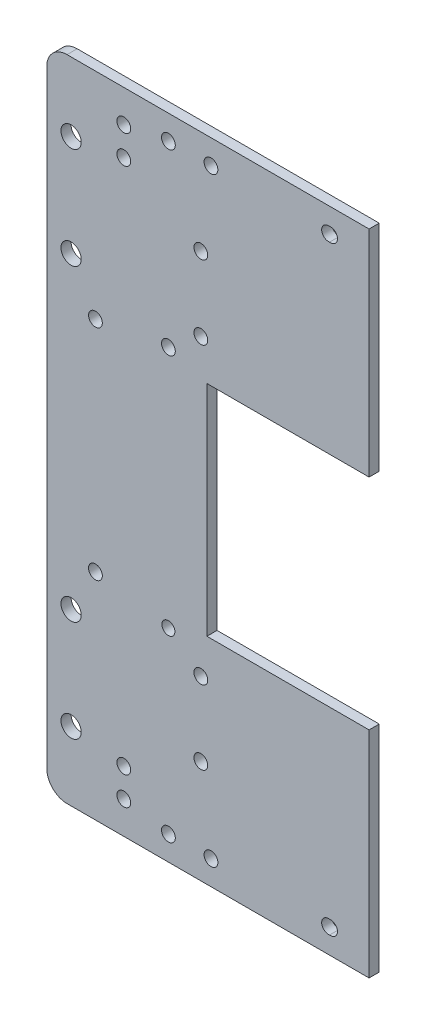
from build123d import *

# Parameters (mm, degrees)
SKETCH_1_W                  = 82
SKETCH_1_H                  = 160
EXTRUDE_1_DEPTH             = 50
SKETCH_2_W                  = 79.5
SKETCH_2_H                  = 47.5
CUT_EXTRUDE_1_DEPTH         = 187.611896727
CUT_EXTRUDE_2_DEPTH         = 186.95765647
CUT_EXTRUDE_4_DEPTH         = 186.95765647
CUT_EXTRUDE_5_DEPTH         = 186.95765647
CUT_EXTRUDE_7_DEPTH         = 186.95765647
CUT_EXTRUDE_9_DEPTH         = 187.611896727
CUT_EXTRUDE_10_DEPTH        = 187.611896727
CUT_EXTRUDE_11_DEPTH        = 187.611896727
CUT_EXTRUDE_12_DEPTH        = 187.611896727
CUT_EXTRUDE_13_DEPTH        = 187.611896727
CUT_EXTRUDE_14_DEPTH        = 187.611896727
CUT_EXTRUDE_15_DEPTH        = 187.611896727
CUT_EXTRUDE_16_DEPTH        = 187.611896727
CUT_EXTRUDE_17_DEPTH        = 187.611896727
CUT_EXTRUDE_18_DEPTH        = 187.611896727
CUT_EXTRUDE_19_DEPTH        = 187.611896727
DRAFT_1_ANGLE               = 30
DRAFT_2_ANGLE               = 30
HOLE_WIZARD_3_2_3_2_1_D     = 3.2
HOLE_WIZARD_3_2_3_2_1_DEPTH = 50
HOLE_WIZARD_3_4_3_4_1_D     = 3.4
HOLE_WIZARD_3_4_3_4_1_DEPTH = 50
HOLE_WIZARD_3_2_3_2_2_D     = 3.2
HOLE_WIZARD_3_2_3_2_2_DEPTH = 82
HOLE_WIZARD_5_0_5_1_D       = 5
HOLE_WIZARD_5_0_5_1_DEPTH   = 50
FILLET_3_R                  = 5
SKETCH_31_W                 = 2.5
SKETCH_31_H                 = 160
CUT_EXTRUDE_21_DEPTH        = 10
SKETCH_32_R                 = 1.7
CUT_EXTRUDE_22_DEPTH        = 10
SKETCH_33_R                 = 1.7
CUT_EXTRUDE_23_DEPTH        = 10
SKETCH_34_W                 = 60.596480557
SKETCH_34_H                 = 37.741752596
SKETCH_34_W_2               = 35.854664966
SKETCH_34_H_2               = 6.290292099
SKETCH_34_W_3               = 37.951428999
SKETCH_34_H_3               = 7.758026922
SKETCH_34_W_4               = 17.193465071
SKETCH_34_H_4               = 10.693496569
SKETCH_34_W_5               = 15.306377442
SKETCH_34_H_5               = 12.999937006
EXTRUDE_2_DEPTH             = 2.5
SKETCH_35_W                 = 40
SKETCH_35_H                 = 27
CUT_EXTRUDE_24_DEPTH        = 179.679881352
SKETCH_37_R                 = 1.7
CUT_EXTRUDE_25_DEPTH        = 10


with BuildPart() as part:
    # 草图1 → 凸台-拉伸1 (new body)
    with BuildSketch(Plane(origin=(0, 0, -50), x_dir=(-1, 0, 0), z_dir=(0, 0, -1))):
        with Locations((-41, 80)):
            Rectangle(SKETCH_1_W, SKETCH_1_H)
    extrude(amount=-EXTRUDE_1_DEPTH)

    # 草图2 → 切除-拉伸1 (cut, through all)
    with BuildSketch(Plane(origin=(0, 160, 0), x_dir=(-1, 0, 0), z_dir=(0, 1, 0))):
        with Locations((-39.75, -26.25)):
            Rectangle(SKETCH_2_W, SKETCH_2_H)
    extrude(amount=-CUT_EXTRUDE_1_DEPTH, mode=Mode.SUBTRACT)

    # 草图3 → 切除-拉伸2 (cut, through all)
    with BuildSketch(Plane(origin=(0, 0, -2.5), x_dir=(-1, 0, 0), z_dir=(0, 0, -1))):
        with BuildLine():
            Line((-65, 89.5), (-20, 89.5))
            ThreePointArc((-20, 89.5), (-17.5, 92), (-20, 94.5))
            Line((-20, 94.5), (-65, 94.5))
            ThreePointArc((-65, 94.5), (-67.5, 92), (-65, 89.5))
        make_face()
    extrude(amount=-CUT_EXTRUDE_2_DEPTH, mode=Mode.SUBTRACT)

    # 草图5 → 切除-拉伸4 (cut, through all)
    with BuildSketch(Plane(origin=(0, 0, -2.5), x_dir=(-1, 0, 0), z_dir=(0, 0, -1))):
        with BuildLine():
            Line((-65, 65.5), (-20, 65.5))
            ThreePointArc((-20, 65.5), (-17.5, 68), (-20, 70.5))
            Line((-20, 70.5), (-65, 70.5))
            ThreePointArc((-65, 70.5), (-67.5, 68), (-65, 65.5))
        make_face()
    extrude(amount=-CUT_EXTRUDE_4_DEPTH, mode=Mode.SUBTRACT)

    # 草图6 → 切除-拉伸5 (cut, through all)
    with BuildSketch(Plane(origin=(0, 0, -2.5), x_dir=(-1, 0, 0), z_dir=(0, 0, -1))):
        with BuildLine():
            Line((-68, 50), (-38, 50))
            ThreePointArc((-38, 50), (-36.4, 51.6), (-38, 53.2))
            Line((-38, 53.2), (-68, 53.2))
            ThreePointArc((-68, 53.2), (-69.6, 51.6), (-68, 50))
        make_face()
    extrude(amount=-CUT_EXTRUDE_5_DEPTH, mode=Mode.SUBTRACT)

    # 草图8 → 切除-拉伸7 (cut, through all)
    with BuildSketch(Plane(origin=(0, 0, -2.5), x_dir=(-1, 0, 0), z_dir=(0, 0, -1))):
        with BuildLine():
            Line((-68, 106.8), (-38, 106.8))
            ThreePointArc((-38, 106.8), (-36.4, 108.4), (-38, 110))
            Line((-38, 110), (-68, 110))
            ThreePointArc((-68, 110), (-69.6, 108.4), (-68, 106.8))
        make_face()
    extrude(amount=-CUT_EXTRUDE_7_DEPTH, mode=Mode.SUBTRACT)

    # 草图10 → 切除-拉伸9 (cut, through all)
    with BuildSketch(Plane(origin=(82, 0, 0), x_dir=(0, 0, -1), z_dir=(1, 0, 0))):
        with BuildLine():
            Line((20.690598923, 80), (16.690598923, 86.92820323))
            ThreePointArc((16.690598923, 86.92820323), (13.629378785, 80), (16.690598923, 73.07179677))
            Line((16.690598923, 73.07179677), (20.690598923, 80))
        make_face()
    extrude(amount=-CUT_EXTRUDE_9_DEPTH, mode=Mode.SUBTRACT)

    # 草图11 → 切除-拉伸10 (cut, through all)
    with BuildSketch(Plane(origin=(82, 0, 0), x_dir=(0, 0, -1), z_dir=(1, 0, 0))):
        with BuildLine():
            Line((24.154700538, 89.29920473), (24.154700538, 82))
            Line((24.154700538, 82), (32.154700538, 82))
            ThreePointArc((32.154700538, 82), (29.315895428, 86.922283358), (24.154700538, 89.29920473))
        make_face()
    extrude(amount=-CUT_EXTRUDE_10_DEPTH, mode=Mode.SUBTRACT)

    # 草图12 → 切除-拉伸11 (cut, through all)
    with BuildSketch(Plane(origin=(82, 0, 0), x_dir=(0, 0, -1), z_dir=(1, 0, 0))):
        with BuildLine():
            Line((24.154700538, 78), (24.154700538, 70.70079527))
            ThreePointArc((24.154700538, 70.70079527), (29.315895428, 73.077716642), (32.154700538, 78))
            Line((32.154700538, 78), (24.154700538, 78))
        make_face()
    extrude(amount=-CUT_EXTRUDE_11_DEPTH, mode=Mode.SUBTRACT)

    # 草图13 → 切除-拉伸12 (cut, through all)
    with BuildSketch(Plane(origin=(82, 0, 0), x_dir=(0, 0, -1), z_dir=(1, 0, 0))):
        with BuildLine():
            Line((36, 21.2), (14, 21.2))
            ThreePointArc((14, 21.2), (12.4, 19.6), (14, 18))
            Line((14, 18), (36, 18))
            ThreePointArc((36, 18), (37.6, 19.6), (36, 21.2))
        make_face()
    extrude(amount=-CUT_EXTRUDE_12_DEPTH, mode=Mode.SUBTRACT)

    # 草图14 → 切除-拉伸13 (cut, through all)
    with BuildSketch(Plane(origin=(82, 0, 0), x_dir=(0, 0, -1), z_dir=(1, 0, 0))):
        with BuildLine():
            Line((36, 31.2), (14, 31.2))
            ThreePointArc((14, 31.2), (12.4, 29.6), (14, 28))
            Line((14, 28), (36, 28))
            ThreePointArc((36, 28), (37.6, 29.6), (36, 31.2))
        make_face()
    extrude(amount=-CUT_EXTRUDE_13_DEPTH, mode=Mode.SUBTRACT)

    # 草图15 → 切除-拉伸14 (cut, through all)
    with BuildSketch(Plane(origin=(82, 0, 0), x_dir=(0, 0, -1), z_dir=(1, 0, 0))):
        with BuildLine():
            Line((36, 41.2), (14, 41.2))
            ThreePointArc((14, 41.2), (12.4, 39.6), (14, 38))
            Line((14, 38), (36, 38))
            ThreePointArc((36, 38), (37.6, 39.6), (36, 41.2))
        make_face()
    extrude(amount=-CUT_EXTRUDE_14_DEPTH, mode=Mode.SUBTRACT)

    # 草图16 → 切除-拉伸15 (cut, through all)
    with BuildSketch(Plane(origin=(82, 0, 0), x_dir=(0, 0, -1), z_dir=(1, 0, 0))):
        with BuildLine():
            Line((36, 51.2), (14, 51.2))
            ThreePointArc((14, 51.2), (12.4, 49.6), (14, 48))
            Line((14, 48), (36, 48))
            ThreePointArc((36, 48), (37.6, 49.6), (36, 51.2))
        make_face()
    extrude(amount=-CUT_EXTRUDE_15_DEPTH, mode=Mode.SUBTRACT)

    # 草图17 → 切除-拉伸16 (cut, through all)
    with BuildSketch(Plane(origin=(82, 0, 0), x_dir=(0, 0, -1), z_dir=(1, 0, 0))):
        with BuildLine():
            Line((36, 112), (14, 112))
            ThreePointArc((14, 112), (12.4, 110.4), (14, 108.8))
            Line((14, 108.8), (36, 108.8))
            ThreePointArc((36, 108.8), (37.6, 110.4), (36, 112))
        make_face()
    extrude(amount=-CUT_EXTRUDE_16_DEPTH, mode=Mode.SUBTRACT)

    # 草图18 → 切除-拉伸17 (cut, through all)
    with BuildSketch(Plane(origin=(82, 0, 0), x_dir=(0, 0, -1), z_dir=(1, 0, 0))):
        with BuildLine():
            Line((36, 122), (14, 122))
            ThreePointArc((14, 122), (12.4, 120.4), (14, 118.8))
            Line((14, 118.8), (36, 118.8))
            ThreePointArc((36, 118.8), (37.6, 120.4), (36, 122))
        make_face()
    extrude(amount=-CUT_EXTRUDE_17_DEPTH, mode=Mode.SUBTRACT)

    # 草图19 → 切除-拉伸18 (cut, through all)
    with BuildSketch(Plane(origin=(82, 0, 0), x_dir=(0, 0, -1), z_dir=(1, 0, 0))):
        with BuildLine():
            Line((36, 132), (14, 132))
            ThreePointArc((14, 132), (12.4, 130.4), (14, 128.8))
            Line((14, 128.8), (36, 128.8))
            ThreePointArc((36, 128.8), (37.6, 130.4), (36, 132))
        make_face()
    extrude(amount=-CUT_EXTRUDE_18_DEPTH, mode=Mode.SUBTRACT)

    # 草图20 → 切除-拉伸19 (cut, through all)
    with BuildSketch(Plane(origin=(82, 0, 0), x_dir=(0, 0, -1), z_dir=(1, 0, 0))):
        with BuildLine():
            Line((36, 142), (14, 142))
            ThreePointArc((14, 142), (12.4, 140.4), (14, 138.8))
            Line((14, 138.8), (36, 138.8))
            ThreePointArc((36, 138.8), (37.6, 140.4), (36, 142))
        make_face()
    extrude(amount=-CUT_EXTRUDE_19_DEPTH, mode=Mode.SUBTRACT)

    # 拔模1
    draft_1_faces = [part.faces().sort_by_distance(p)[0] for p in [
        (80.75, 85.649602365, -24.154700538),
    ]]
    draft(draft_1_faces, Plane(origin=(0, 82, -24.154700538), x_dir=(0, 0, 1), z_dir=(0, 1, 0)), DRAFT_1_ANGLE)

    # 拔模2
    draft_2_faces = [part.faces().sort_by_distance(p)[0] for p in [
        (80.75, 74.350397635, -24.154700538),
    ]]
    draft(draft_2_faces, Plane(origin=(0, 78, -32.154700538), x_dir=(0, 0, -1), z_dir=(0, -1, 0)), DRAFT_2_ANGLE)

    # Ø3.2 (3.2) 直径孔1
    with Locations(Plane.XY):
        with Locations((30, 32.75), (30, 38.75), (30, 50)):
            Hole(HOLE_WIZARD_3_2_3_2_1_D / 2, depth=HOLE_WIZARD_3_2_3_2_1_DEPTH)

    # Ø3.4 (3.4) 直径孔1
    with Locations(Plane.XY):
        with Locations((30, 154), (40.5, 154), (69.5, 154), (69.5, 6), (40.5, 6), (30, 6), (30, 121.25), (30, 127.25), (30, 110), (19, 8), (19, 15), (19, 145), (12, 53), (12, 107), (19, 152), (22, 124.25), (22, 35.75)):
            Hole(HOLE_WIZARD_3_4_3_4_1_D / 2, depth=HOLE_WIZARD_3_4_3_4_1_DEPTH)

    # Ø3.2 (3.2) 直径孔2
    with Locations(Plane(origin=(82, 0, 0), x_dir=(0, 0, -1), z_dir=(1, 0, 0))):
        with Locations((9.5, 150), (17.5, 150), (25.5, 150), (33.5, 150), (41.5, 150), (41.5, 10), (33.5, 10), (25.5, 10), (17.5, 10), (10.5, 90), (23, 100), (35.5, 90), (9.5, 10), (35.5, 70), (23, 60), (10.5, 70)):
            Hole(HOLE_WIZARD_3_2_3_2_2_D / 2, depth=HOLE_WIZARD_3_2_3_2_2_DEPTH)

    # Ø5.0 (5) 直径孔1
    with Locations(Plane.XY):
        with Locations((6, 17), (6, 42), (6, 118), (6, 143)):
            Hole(HOLE_WIZARD_5_0_5_1_D / 2, depth=HOLE_WIZARD_5_0_5_1_DEPTH)

    # 圆角3
    fillet_3_edges = [part.edges().sort_by_distance(p)[0] for p in [
        (80.75, 160, -50),
        (80.75, 0, -50),
        (0, 160, -1.25),
        (0, 0, -1.25),
    ]]
    fillet(fillet_3_edges, radius=FILLET_3_R)

    # 草图31 → 切除-拉伸21 (cut)
    with BuildSketch(Plane.ZY.offset(-79.5)):
        with Locations((-1.25, 80)):
            Rectangle(SKETCH_31_W, SKETCH_31_H)
    extrude(amount=-CUT_EXTRUDE_21_DEPTH, mode=Mode.SUBTRACT)


with BuildPart() as body_2:
    # of the pieces the cut leaves, the one that is kept (cut_extrude_21_keep)
    add(part.part.solids().sort_by_distance((5, 160, -2.5))[0])

    # 草图32 → 切除-拉伸22 (cut)
    with BuildSketch(Plane.XY):
        with Locations((38, 25.5)):
            Circle(SKETCH_32_R)
        with Locations((38, 43.7)):
            Circle(SKETCH_32_R)
    extrude(amount=-CUT_EXTRUDE_22_DEPTH, mode=Mode.SUBTRACT)

    # 草图33 → 切除-拉伸23 (cut)
    with BuildSketch(Plane.XY):
        with Locations((38, 134.5)):
            Circle(SKETCH_33_R)
        with Locations((38, 116.3)):
            Circle(SKETCH_33_R)
    extrude(amount=-CUT_EXTRUDE_23_DEPTH, mode=Mode.SUBTRACT)

    # 草图34 → 凸台-拉伸2 (add)
    with BuildSketch(Plane.XY):
        with Locations((44.153204469, 79.233741422)):
            Rectangle(SKETCH_34_W, SKETCH_34_H)
        with Locations((52.540260602, 108.378761482)):
            Rectangle(SKETCH_34_W_2, SKETCH_34_H_2)
        with Locations((53.588642619, 51.032265177)):
            Rectangle(SKETCH_34_W_3, SKETCH_34_H_3)
        with Locations((26.016195584, 35.096858526)):
            Rectangle(SKETCH_34_W_4, SKETCH_34_H_4)
        with Locations((26.959739398, 123.47546252)):
            Rectangle(SKETCH_34_W_5, SKETCH_34_H_5)
    extrude(amount=-EXTRUDE_2_DEPTH)

    # 草图35 → 切除-拉伸24 (cut, through all)
    with BuildSketch(Plane.XY):
        Polygon((79.5, 64.187810857), (79.5, 80), (39.5, 80), (39.5, 53), (79.5, 53), align=None)
        with Locations((59.5, 93.5)):
            Rectangle(SKETCH_35_W, SKETCH_35_H)
    extrude(amount=-CUT_EXTRUDE_24_DEPTH, mode=Mode.SUBTRACT)

    # 草图37 → 切除-拉伸25 (cut)
    with BuildSketch(Plane.XY):
        with Locations((70, 6)):
            Circle(SKETCH_37_R)
        with Locations((70, 154)):
            Circle(SKETCH_37_R)
    extrude(amount=-CUT_EXTRUDE_25_DEPTH, mode=Mode.SUBTRACT)


solid = body_2.part
